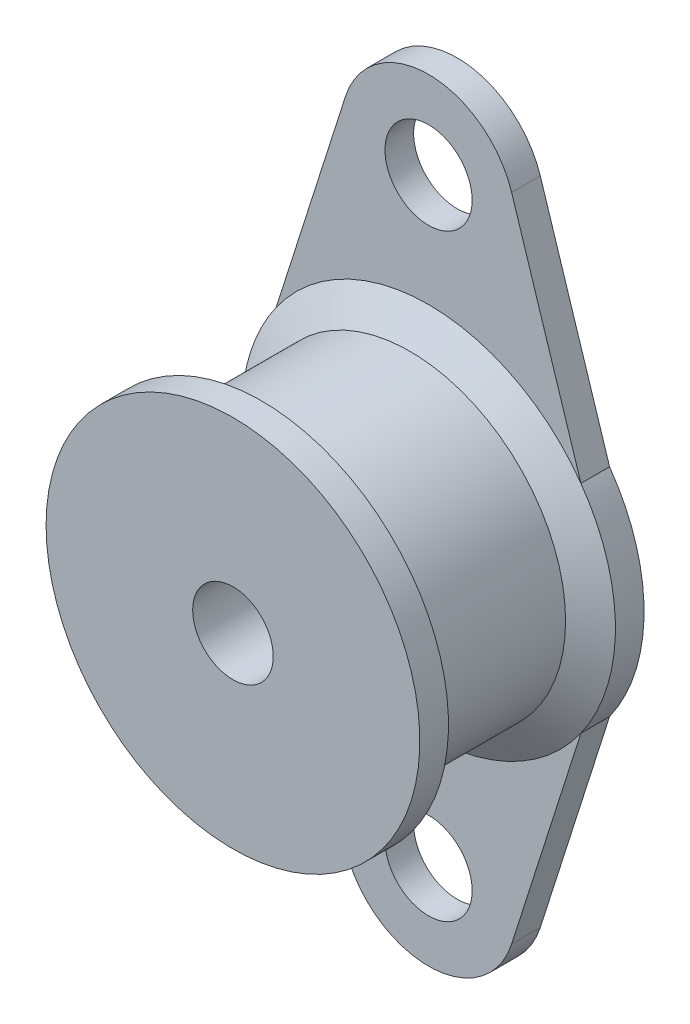
from build123d import *

# Parameters (mm, degrees)
SKETCH_1_R      = 3.5
EXTRUDE_1_DEPTH = 2.3
SKETCH_3_W      = 15
SKETCH_3_H      = 2.3


with BuildPart() as part:
    # 草图1 → 凸台-拉伸1 (new body)
    with BuildSketch(Plane.XY):
        with BuildLine():
            Line((-12.231269749, -8.683089331), (-6.66916341, -26.126560465))
            ThreePointArc((-6.66916341, -26.126560465), (0, -31), (6.66916341, -26.126560465))
            Line((6.66916341, -26.126560465), (12.231269749, -8.683089331))
            ThreePointArc((12.231269749, -8.683089331), (15, 0), (12.231269749, 8.683089331))
            Line((12.231269749, 8.683089331), (6.66916341, 26.126560465))
            ThreePointArc((6.66916341, 26.126560465), (0, 31), (-6.66916341, 26.126560465))
            Line((-6.66916341, 26.126560465), (-12.231269749, 8.683089331))
            ThreePointArc((-12.231269749, 8.683089331), (-15, 0), (-12.231269749, -8.683089331))
        make_face()
        with Locations((0, -24)):
            Circle(SKETCH_1_R, mode=Mode.SUBTRACT)
        with Locations((0, 24)):
            Circle(SKETCH_1_R, mode=Mode.SUBTRACT)
    extrude(amount=EXTRUDE_1_DEPTH)

    # 草图2 → 旋转1 (revolve)
    with BuildSketch(Plane(origin=(0, 0, 0), x_dir=(1, 0, 0), z_dir=(0, 1, 0)), mode=Mode.PRIVATE) as revolve_1_sk:
        Polygon((0, -2.3), (15, -2.3), (12.5, -3.8), (12.5, -14.2), (15, -15.7), (0, -15.7), align=None)
    revolve(revolve_1_sk.sketch.rotate(Axis((0, 0, 15.7), (0, 0, -1)), 180), axis=Axis((0, 0, 15.7), (0, 0, -1)))

    # 草图3 → 旋转2 (revolve)
    with BuildSketch(Plane(origin=(0, 0, 0), x_dir=(1, 0, 0), z_dir=(0, 1, 0)), mode=Mode.PRIVATE) as revolve_2_sk:
        with Locations((7.5, -16.85)):
            Rectangle(SKETCH_3_W, SKETCH_3_H)
    revolve(revolve_2_sk.sketch.rotate(Axis((0, 0, 18), (0, 0, -1)), 180), axis=Axis((0, 0, 18), (0, 0, -1)))

    # 草图4 → 切除-旋转1 (revolve, cut)
    with BuildSketch(Plane(origin=(0, 0, 0), x_dir=(1, 0, 0), z_dir=(0, 1, 0)), mode=Mode.PRIVATE) as cut_revolve_1_sk:
        Polygon((0, -10.8), (4, -10.8), (3.233, -11.3), (3.233, -18), (0, -18), align=None)
    revolve(cut_revolve_1_sk.sketch.rotate(Axis((0, 0, 18), (0, 0, -1)), 180), axis=Axis((0, 0, 18), (0, 0, -1)), mode=Mode.SUBTRACT)


solid = part.part
